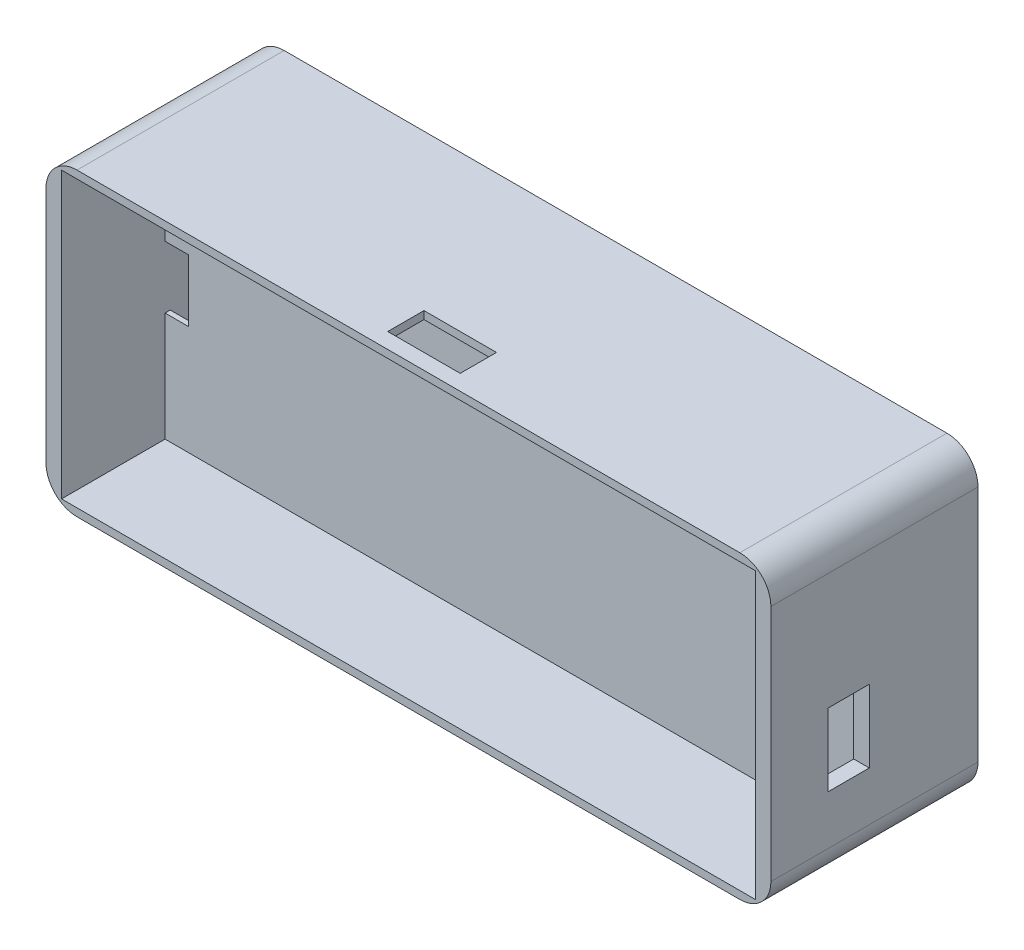
from build123d import *

# Parameters (mm, degrees)
SKETCH_1_W          = 134
SKETCH_1_H          = 33
EXTRUDE_1_DEPTH     = 40
EXTRUDE_START       = 19
SKETCH_2_W          = 134
SKETCH_2_H          = 33
EXTRUDE_2_DEPTH     = 3
SKETCH_3_W          = 4.5
SKETCH_3_H          = 12
CUT_EXTRUDE_1_DEPTH = 79.625695545
SKETCH_4_W          = 134
SKETCH_4_H          = 55
CUT_EXTRUDE_2_DEPTH = 20
SKETCH_6_W          = 14
SKETCH_6_H          = 7
CUT_EXTRUDE_3_DEPTH = 10
SKETCH_7_W          = 8
SKETCH_7_H          = 14
CUT_EXTRUDE_4_DEPTH = 10
SKETCH_8_W          = 133
SKETCH_8_H          = 3
CUT_EXTRUDE_5_DEPTH = 10


with BuildPart() as part:
    # 草图1 → 凸台-拉伸1 (new body)
    with BuildSketch(Plane.XY):
        with BuildLine():
            Line((-64, 29), (64, 29))
            ThreePointArc((64, 29), (68.242640687, 27.242640687), (70, 23))
            Line((70, 23), (70, -23))
            ThreePointArc((70, -23), (68.242640687, -27.242640687), (64, -29))
            Line((64, -29), (-64, -29))
            ThreePointArc((-64, -29), (-68.242640687, -27.242640687), (-70, -23))
            Line((-70, -23), (-70, 23))
            ThreePointArc((-70, 23), (-68.242640687, 27.242640687), (-64, 29))
        make_face()
        Rectangle(SKETCH_1_W, SKETCH_1_H, mode=Mode.SUBTRACT)
    extrude(amount=EXTRUDE_1_DEPTH)

    # 草图2 → 凸台-拉伸2 (add)
    with BuildSketch(Plane.XY.offset(EXTRUDE_START)):
        Rectangle(SKETCH_2_W, SKETCH_2_H)
    extrude(amount=EXTRUDE_2_DEPTH)

    # 草图3 → 切除-拉伸1 (cut, through all)
    with BuildSketch(Plane(origin=(0, 0, 19), x_dir=(-1, 0, 0), z_dir=(0, 0, -1))):
        with Locations((64.75, -0.409735633)):
            Rectangle(SKETCH_3_W, SKETCH_3_H)
    extrude(amount=-CUT_EXTRUDE_1_DEPTH, mode=Mode.SUBTRACT)

    # 草图4 → 切除-拉伸2 (cut)
    with BuildSketch(Plane.XY.offset(40)):
        Rectangle(SKETCH_4_W, SKETCH_4_H)
    extrude(amount=-CUT_EXTRUDE_2_DEPTH, mode=Mode.SUBTRACT)

    # 草图6 → 切除-拉伸3 (cut)
    with BuildSketch(Plane(origin=(0, 29, 0), x_dir=(1, 0, 0), z_dir=(0, 1, 0))):
        with Locations((0, -33.5)):
            Rectangle(SKETCH_6_W, SKETCH_6_H)
    extrude(amount=-CUT_EXTRUDE_3_DEPTH, mode=Mode.SUBTRACT)

    # 草图7 → 切除-拉伸4 (cut)
    with BuildSketch(Plane.ZY.offset(-67)):
        with Locations((25, -6.5)):
            Rectangle(SKETCH_7_W, SKETCH_7_H)
    extrude(amount=-CUT_EXTRUDE_4_DEPTH, mode=Mode.SUBTRACT)

    # 草图8 → 切除-拉伸5 (cut)
    with BuildSketch(Plane(origin=(0, 0, 0), x_dir=(-1, 0, 0), z_dir=(0, 0, -1))):
        with Locations((0.239080463, 24)):
            Rectangle(SKETCH_8_W, SKETCH_8_H)
        with Locations((0.239080463, -24)):
            Rectangle(SKETCH_8_W, SKETCH_8_H)
    extrude(amount=-CUT_EXTRUDE_5_DEPTH, mode=Mode.SUBTRACT)


solid = part.part
